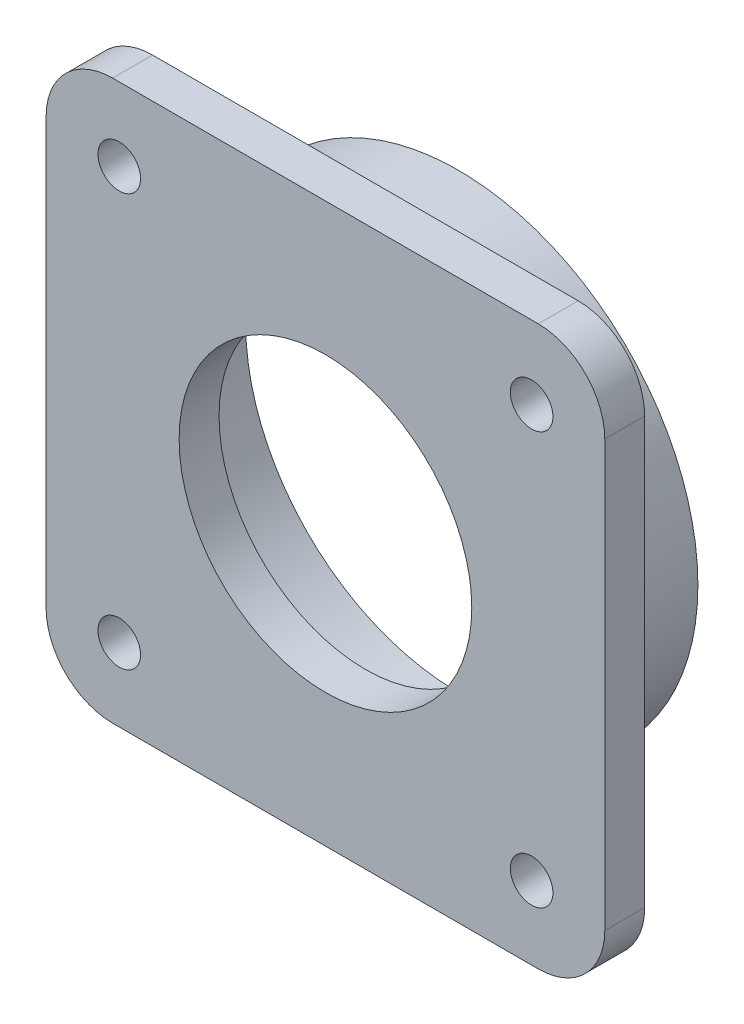
from build123d import *

# Parameters (mm, degrees)
SKETCH_1_W      = 42
SKETCH_1_H      = 42
SKETCH_1_R      = 1.6
SKETCH_1_R_2    = 11
EXTRUDE_1_DEPTH = 3
FILLET_1_R      = 5
SKETCH_2_R      = 18
SKETCH_2_R_2    = 16
EXTRUDE_2_DEPTH = 7


with BuildPart() as part:
    # 草图1 → 凸台-拉伸1 (new body)
    with BuildSketch(Plane.XY):
        Rectangle(SKETCH_1_W, SKETCH_1_H)
        with Locations((-15.5, 15.5)):
            Circle(SKETCH_1_R, mode=Mode.SUBTRACT)
        with Locations((15.5, 15.5)):
            Circle(SKETCH_1_R, mode=Mode.SUBTRACT)
        with Locations((15.5, -15.5)):
            Circle(SKETCH_1_R, mode=Mode.SUBTRACT)
        with Locations((-15.5, -15.5)):
            Circle(SKETCH_1_R, mode=Mode.SUBTRACT)
        Circle(SKETCH_1_R_2, mode=Mode.SUBTRACT)
    extrude(amount=EXTRUDE_1_DEPTH)

    # 圆角1
    fillet_1_edges = [part.edges().sort_by_distance(p)[0] for p in [
        (-21, -21, 1.5),
        (-21, 21, 1.5),
        (21, 21, 1.5),
        (21, -21, 1.5),
    ]]
    fillet(fillet_1_edges, radius=FILLET_1_R)

    # 草图2 → 凸台-拉伸2 (add)
    with BuildSketch(Plane(origin=(0, 0, 0), x_dir=(-1, 0, 0), z_dir=(0, 0, -1))):
        with Locations(Location((0, 0, 0), (0, 0, 180))):
            Circle(SKETCH_2_R)
        Circle(SKETCH_2_R_2, mode=Mode.SUBTRACT)
    extrude(amount=EXTRUDE_2_DEPTH)


solid = part.part
